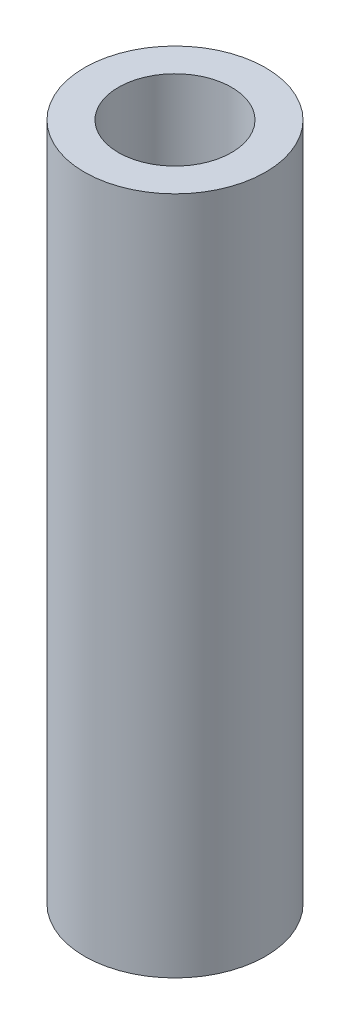
from build123d import *

# Parameters (mm, degrees)
SKETCH_1_R      = 2
SKETCH_1_R_2    = 1.25
EXTRUDE_1_DEPTH = 15


with BuildPart() as part:
    # 草图1 → 凸台-拉伸1 (new body)
    with BuildSketch(Plane(origin=(0, 0, 0), x_dir=(1, 0, 0), z_dir=(0, 1, 0))):
        with Locations(Location((0, 0, 0), (0, 0, 270))):
            Circle(SKETCH_1_R)
        with Locations(Location((0, 0, 0), (0, 0, 270))):
            Circle(SKETCH_1_R_2, mode=Mode.SUBTRACT)
    extrude(amount=EXTRUDE_1_DEPTH)


solid = part.part
